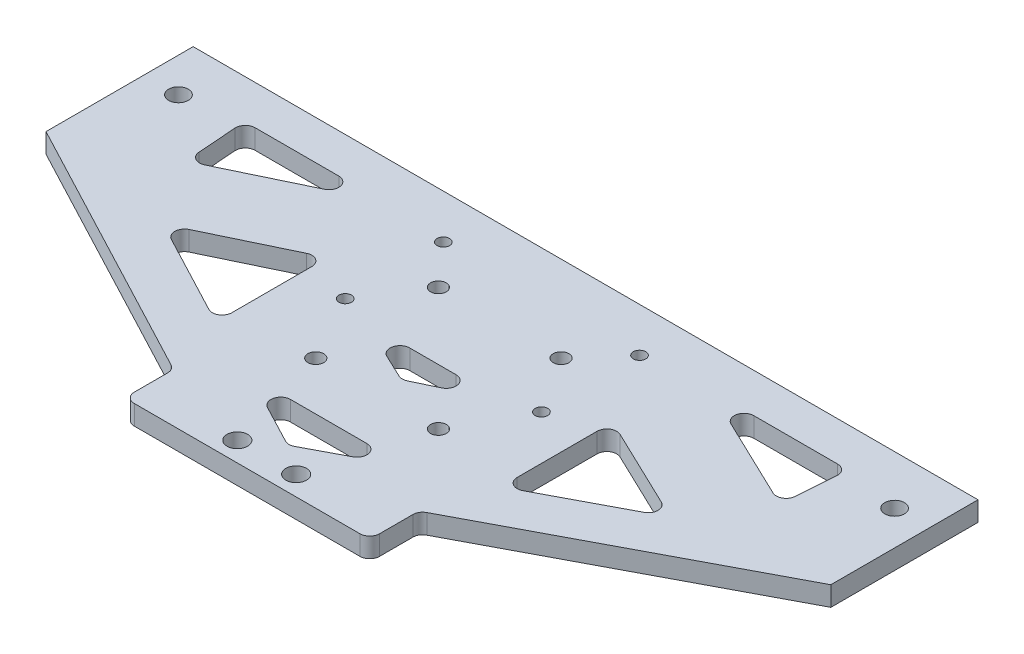
from build123d import *

# Parameters (mm, degrees)
EXTRUDE_1_DEPTH     = 4
SKETCH_2_R          = 1.6
CUT_EXTRUDE_1_DEPTH = 100.483667001
SKETCH_4_R          = 1.275
CUT_EXTRUDE_3_DEPTH = 10
SKETCH_6_W          = 50
SKETCH_6_H          = 10
EXTRUDE_2_DEPTH     = 4
SKETCH_7_R          = 2.1
CUT_EXTRUDE_4_DEPTH = 10
SKETCH_8_R          = 2
CUT_EXTRUDE_5_DEPTH = 10
CUT_EXTRUDE_6_DEPTH = 10
CUT_EXTRUDE_7_DEPTH = 10
FILLET_2_R          = 2


with BuildPart() as part:
    # 草图1 → 凸台-拉伸1 (new body)
    with BuildSketch(Plane(origin=(0, 0, 0), x_dir=(1, 0, 0), z_dir=(0, 1, 0))):
        Polygon((25, 0), (-25, 0), (-80, 29), (-80, 59), (80, 59), (80, 29), align=None)
    extrude(amount=EXTRUDE_1_DEPTH)

    # 草图2 → 切除-拉伸1 (cut, through all)
    with BuildSketch(Plane(origin=(0, 4, 0), x_dir=(1, 0, 0), z_dir=(0, 1, 0))):
        with Locations(Location((-12.5, 41.5, 0), (0, 0, 270))):
            Circle(SKETCH_2_R)
        with Locations(Location((12.5, 41.5, 0), (0, 0, 90))):
            Circle(SKETCH_2_R)
        with Locations(Location((-12.5, 16.5, 0), (0, 0, 90))):
            Circle(SKETCH_2_R)
        with Locations(Location((12.5, 16.5, 0), (0, 0, 270))):
            Circle(SKETCH_2_R)
    extrude(amount=-CUT_EXTRUDE_1_DEPTH, mode=Mode.SUBTRACT)

    # 草图4 → 切除-拉伸3 (cut)
    with BuildSketch(Plane(origin=(0, 4, 0), x_dir=(1, 0, 0), z_dir=(0, 1, 0))):
        with Locations(Location((20, 50, 0), (0, 0, 270))):
            Circle(SKETCH_4_R)
        with Locations(Location((20, 30, 0), (0, 0, 270))):
            Circle(SKETCH_4_R)
        with Locations(Location((-20, 30, 0), (0, 0, 90))):
            Circle(SKETCH_4_R)
        with Locations(Location((-20, 50, 0), (0, 0, 90))):
            Circle(SKETCH_4_R)
    extrude(amount=-CUT_EXTRUDE_3_DEPTH, mode=Mode.SUBTRACT)

    # 草图6 → 凸台-拉伸2 (add)
    with BuildSketch(Plane(origin=(0, 4, 0), x_dir=(1, 0, 0), z_dir=(0, 1, 0))):
        with Locations((0, -5)):
            Rectangle(SKETCH_6_W, SKETCH_6_H)
    extrude(amount=-EXTRUDE_2_DEPTH)

    # 草图7 → 切除-拉伸4 (cut)
    with BuildSketch(Plane(origin=(0, 4, 0), x_dir=(1, 0, 0), z_dir=(0, 1, 0))):
        with Locations(Location((-6, -6, 0), (0, 0, 270))):
            Circle(SKETCH_7_R)
        with Locations(Location((6, -6, 0), (0, 0, 90))):
            Circle(SKETCH_7_R)
    extrude(amount=-CUT_EXTRUDE_4_DEPTH, mode=Mode.SUBTRACT)

    # 草图8 → 切除-拉伸5 (cut)
    with BuildSketch(Plane(origin=(0, 4, 0), x_dir=(1, 0, 0), z_dir=(0, 1, 0))):
        with Locations(Location((-73, 49, 0), (0, 0, 270))):
            Circle(SKETCH_8_R)
        with Locations(Location((73, 49, 0), (0, 0, 90))):
            Circle(SKETCH_8_R)
    extrude(amount=-CUT_EXTRUDE_5_DEPTH, mode=Mode.SUBTRACT)

    # 草图9 → 切除-拉伸6 (cut)
    with BuildSketch(Plane(origin=(0, 4, 0), x_dir=(1, 0, 0), z_dir=(0, 1, 0))):
        Polygon((-13.607153835, 27.875584016), (13.607153835, 27.875584016), (0, 21.424785161), align=None)
        Polygon((-61.511227824, 51), (-33.511227824, 51), (-60.564799252, 38.03449681), align=None)
        Polygon((-51.708784474, 24.598987773), (-29.079791665, 35.443998725), (-29.079791665, 12.667337019), align=None)
        Polygon((29.079791665, 12.667337019), (51.708784474, 24.598987773), (29.079791665, 35.443998725), align=None)
        Polygon((60.564799252, 38.03449681), (61.511227824, 51), (33.511227824, 51), align=None)
    extrude(amount=-CUT_EXTRUDE_6_DEPTH, mode=Mode.SUBTRACT)

    # 草图10 → 切除-拉伸7 (cut)
    with BuildSketch(Plane(origin=(0, 4, 0), x_dir=(1, 0, 0), z_dir=(0, 1, 0))):
        Polygon((-15.862821337, 6.636596525), (15.862821337, 6.636596525), (0, -1.727436544), align=None)
    extrude(amount=-CUT_EXTRUDE_7_DEPTH, mode=Mode.SUBTRACT)

    # 圆角2
    fillet_2_edges = [part.edges().sort_by_distance(p)[0] for p in [
        (25, 2, 0),
        (-25, 2, 0),
        (60.564799252, 2, -38.03449681),
        (33.511227824, 2, -51),
        (61.511227824, 2, -51),
        (29.079791665, 2, -12.667337019),
        (29.079791665, 2, -35.443998725),
        (51.708784474, 2, -24.598987773),
        (-29.079791665, 2, -12.667337019),
        (-51.708784474, 2, -24.598987773),
        (-29.079791665, 2, -35.443998725),
        (-60.564799252, 2, -38.03449681),
        (-61.511227824, 2, -51),
        (-33.511227824, 2, -51),
        (0, 2, -21.424785161),
        (-13.607153835, 2, -27.875584016),
        (13.607153835, 2, -27.875584016),
        (15.862821337, 2, -6.636596525),
        (0, 2, 1.727436544),
        (-15.862821337, 2, -6.636596525),
        (25, 2, 10),
        (-25, 2, 10),
    ]]
    fillet(fillet_2_edges, radius=FILLET_2_R)


solid = part.part
